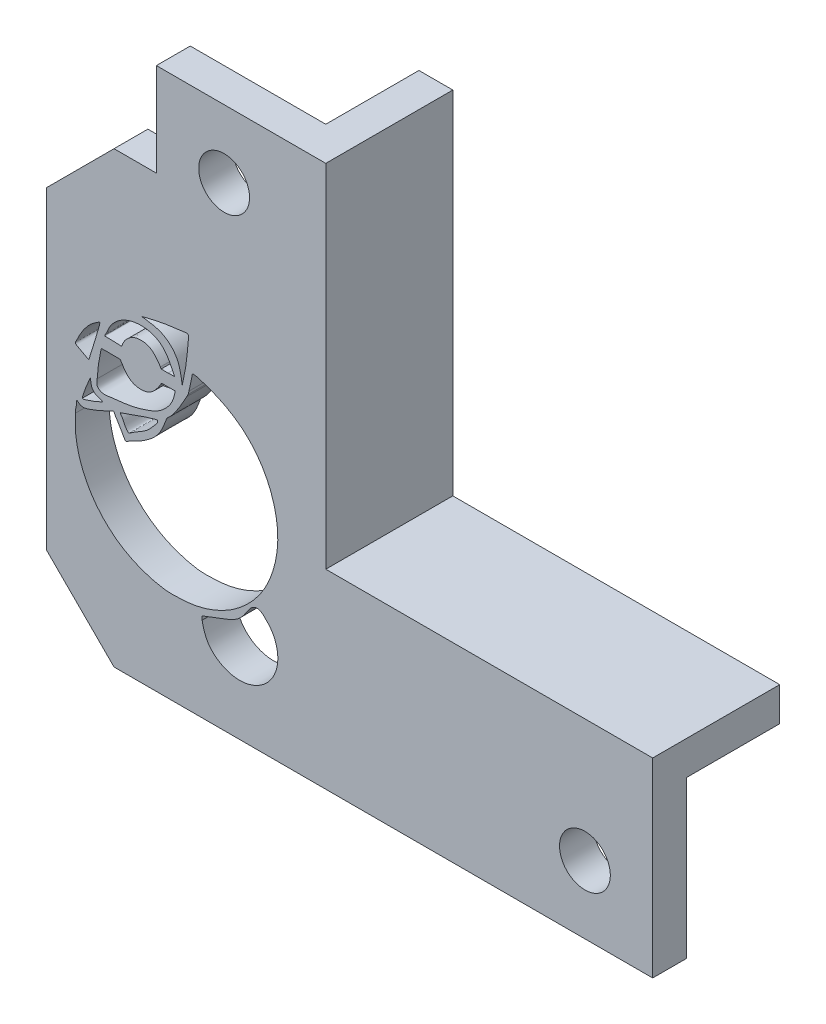
from build123d import *

# Parameters (mm, degrees)
CROQUIS1_R              = 1.5
SALIENTE_EXTRUIR1_DEPTH = 2
SALIENTE_EXTRUIR2_DEPTH = 7.5
CHAFL_N1_SIZE           = 4
CORTAR_EXTRUIR1_START   = -32
CROQUIS4_W              = 52.573461271
CROQUIS4_H              = 46.310311646
CORTAR_EXTRUIR1_DEPTH   = 32
CROQUIS5_W              = 10.5
CROQUIS5_H              = 26.5
SALIENTE_EXTRUIR3_DEPTH = 2
CHAFL_N2_SIZE           = 4
CORTAR_EXTRUIR2_REACH   = 63.708


with BuildPart() as part:
    # Croquis1 → Saliente-Extruir1 (new body)
    with BuildSketch(Plane.XY):
        Polygon((13.378145297, -2.248701868), (-7.921854703, -2.248701868), (-7.921854703, -24.998701868), (-15.921854703, -24.998701868), (-15.921854703, 7.001298132), (13.378145297, 7.001298132), align=None)
        with Locations((9.378145297, 3.001298132)):
            Circle(CROQUIS1_R, mode=Mode.SUBTRACT)
        with Locations((-11.921854703, -20.998701868)):
            Circle(CROQUIS1_R, mode=Mode.SUBTRACT)
    extrude(amount=-SALIENTE_EXTRUIR1_DEPTH)

    # Croquis3 → Saliente-Extruir2 (add)
    with BuildSketch(Plane.XY):
        Polygon((13.378145297, -2.248701868), (13.378145297, -4.248701868), (-5.921854703, -4.248701868), (-5.921854703, -24.998701868), (-7.921854703, -24.998701868), (-7.921854703, -2.248701868), align=None)
    extrude(amount=-SALIENTE_EXTRUIR2_DEPTH)

    # Chaflán1
    chafl_n1_edges = [part.edges().sort_by_distance(p)[0] for p in [
        (-15.921854703, 7.001298132, -1),
    ]]
    chamfer(chafl_n1_edges, length=CHAFL_N1_SIZE)

    # Simetría1: part across plane


with BuildPart() as part_1:
    add(part.part)
    add(part.part.mirror(Plane(origin=(0, -24.998701868, 0), x_dir=(0, 0, 1), z_dir=(0, -1, 0))))

    # Croquis4 → Cortar-Extruir1 (cut)
    with BuildSketch(Plane(origin=(0, 7.001298132, 0), x_dir=(1, 0, 0), z_dir=(0, 1, 0)).offset(CORTAR_EXTRUIR1_START)):
        with Locations((-0.931651779, 5.459653858)):
            Rectangle(CROQUIS4_W, CROQUIS4_H)
    extrude(amount=CORTAR_EXTRUIR1_DEPTH, mode=Mode.SUBTRACT)

    # Croquis5 → Saliente-Extruir3 (add)
    with BuildSketch(Plane.XY):
        with Locations((-17.171854703, -43.748701868)):
            Rectangle(CROQUIS5_W, CROQUIS5_H)
    extrude(amount=-SALIENTE_EXTRUIR3_DEPTH)

    # Chaflán2
    chafl_n2_edges = [part_1.edges().sort_by_distance(p)[0] for p in [
        (-22.421854703, -30.498701868, -1),
        (-22.421854703, -56.998701868, -1),
    ]]
    chamfer(chafl_n2_edges, length=CHAFL_N2_SIZE)

    # Croquis8 → Cortar-Extruir2 (cut, up to next)
    with BuildSketch(Plane.XY, mode=Mode.PRIVATE) as cortar_extruir2_sk1:
        with BuildLine():
            Line((-14.044729544, -40.872173253), (-14.129646544, -41.032729253))
            add(Edge.make_bspline(
                [(-20.705006544, -45.167052253), (-20.703037827, -45.133294056), (-20.699155691, -45.066725874), (-20.690742023, -44.969351431), (-20.677415733, -44.87833843), (-20.655365047, -44.79262746), (-20.636609746, -44.701448419), (-20.635500295, -44.615669691), (-20.639914268, -44.544339253), (-20.644246363, -44.494139489), (-20.6185225, -44.468164443), (-20.604262681, -44.468096191), (-20.600747971, -44.468337758), (-20.595851951, -44.46925171), (-20.589884195, -44.471844597), (-20.583430438, -44.476473908), (-20.576322835, -44.482648915), (-20.568128949, -44.489699828), (-20.558856877, -44.497542435), (-20.540821317, -44.512496469), (-20.513371946, -44.534018742), (-20.475141216, -44.560246941), (-20.434692418, -44.583122107), (-20.391966343, -44.601386897), (-20.347580458, -44.614988369), (-20.302026695, -44.623900063), (-20.255814326, -44.628063216), (-20.209445241, -44.628082217), (-20.135935247, -44.622553881), (-20.036199309, -44.602844305), (-19.913270508, -44.563311236), (-19.772080643, -44.509385453), (-19.61032218, -44.448814252), (-19.428985662, -44.379289174), (-19.245627792, -44.303936615), (-19.061640101, -44.219518609), (-18.875946522, -44.130882189), (-18.734104659, -44.064959045), (-18.635741238, -44.022095238), (-18.581881449, -43.996632733), (-18.539406349, -43.972737845), (-18.508269695, -43.952296584), (-18.486074791, -43.940684577), (-18.467229743, -43.937106582), (-18.454564891, -43.93839348), (-18.447726872, -43.939935972), (-18.433471082, -43.944924698), (-18.414792223, -43.962298457), (-18.401299755, -43.993678435), (-18.3856017, -44.04272852), (-18.357111095, -44.103454882), (-18.312778104, -44.170911649), (-18.260678998, -44.242945118), (-18.207767567, -44.327022469), (-18.153135778, -44.422896087), (-18.099697661, -44.520339315), (-18.045333167, -44.617118162), (-17.989943878, -44.712013455), (-17.938338551, -44.795842909), (-17.890274581, -44.86927064), (-17.848415814, -44.936648836), (-17.817766956, -44.99414292), (-17.797123087, -45.039650307), (-17.782382623, -45.067403116), (-17.756690298, -45.101624833), (-17.688741807, -45.104654868), (-17.61798697, -45.062240499), (-17.515561588, -44.995442849), (-17.388354369, -44.92223379), (-17.238412818, -44.854991018), (-17.096917049, -44.793305515), (-16.959949712, -44.720926595), (-16.823633083, -44.640548028), (-16.657502885, -44.535647549), (-16.464665793, -44.407961516), (-16.252183325, -44.249596382), (-16.064242859, -44.08305661), (-15.902717467, -43.907541978), (-15.765504043, -43.727724115), (-15.636220567, -43.520576014), (-15.522864406, -43.284281385), (-15.420327532, -43.023627653), (-15.354060554, -42.84434064), (-15.317235164, -42.749217882), (-15.312330024, -42.737840593), (-15.306465283, -42.726638347), (-15.299171159, -42.71595604), (-15.2907219, -42.705764696), (-15.280116284, -42.694585912), (-15.267386218, -42.68251691), (-15.252612806, -42.669562233), (-15.20242959, -42.626712199), (-15.120995523, -42.548812492), (-15.014801413, -42.430142918), (-14.902090336, -42.289341679), (-14.78271542, -42.127348778), (-14.65827842, -41.943582163), (-14.530197668, -41.740368587), (-14.398672187, -41.517616031), (-14.262880095, -41.275930433), (-14.174064465, -41.113808611), (-14.129646544, -41.032729253)],
                knots=[0, 0, 0, 0, 0.010102461, 0.019921161, 0.029199228, 0.037535452, 0.046355222, 0.056958127, 0.062929856, 0.067936689, 0.071475868, 0.071821303, 0.072174958, 0.07252821, 0.073304587, 0.074093107, 0.074893885, 0.076117244, 0.077322893, 0.078522026, 0.083117058, 0.087738974, 0.092361577, 0.096976683, 0.101592925, 0.106206404, 0.110819148, 0.115433642, 0.120044404, 0.132827452, 0.145679187, 0.158589989, 0.177979346, 0.197285621, 0.216611642, 0.237194022, 0.257754182, 0.27809032, 0.283918991, 0.289810489, 0.29588416, 0.298456043, 0.300940948, 0.303333987, 0.30403246, 0.30473431, 0.305424104, 0.308530173, 0.311930188, 0.315560225, 0.323929498, 0.331848343, 0.339651892, 0.350488604, 0.361503747, 0.372618426, 0.383691593, 0.394666847, 0.405444846, 0.413096848, 0.420887988, 0.429132565, 0.432553991, 0.435785551, 0.438589189, 0.444871479, 0.453410879, 0.463206766, 0.481416821, 0.497174303, 0.512277313, 0.527523731, 0.543418375, 0.559550164, 0.58622093, 0.612500223, 0.638664539, 0.661116856, 0.683659116, 0.706150103, 0.733948749, 0.76181638, 0.789817342, 0.791056612, 0.792290263, 0.793517394, 0.794828072, 0.796146494, 0.797468753, 0.799429686, 0.80138505, 0.803338704, 0.819145188, 0.835000317, 0.850886116, 0.873014149, 0.895102365, 0.917178253, 0.944771031, 0.972379231, 1, 1, 1, 1], degree=3))
            add(Edge.make_bspline(
                [(-13.998423544, -40.681013253), (-13.990343732, -40.64680302), (-13.974158665, -40.578274824), (-13.950338218, -40.475087032), (-13.927191014, -40.370023541), (-13.905348443, -40.263317985), (-13.88382684, -40.156269636), (-13.863296522, -40.058123119), (-13.842694337, -39.968229842), (-13.82541877, -39.882576034), (-13.815930974, -39.811848315), (-13.811462831, -39.758228536), (-13.805947222, -39.726469143), (-13.791130933, -39.698670483), (-13.761788679, -39.68670709), (-13.729156011, -39.685116117), (-13.675047312, -39.689085845), (-13.604052708, -39.698873294), (-13.519005633, -39.717716538), (-13.171829075, -39.813721641), (-12.556867704, -40.022005641), (-11.705924127, -40.422265383), (-10.914526634, -40.939788031), (-10.235199352, -41.583674084), (-9.680432935, -42.322325548), (-9.244961462, -43.144366644), (-8.935442852, -44.02981885), (-8.762202688, -44.957606633), (-8.740525264, -45.735844745), (-8.798629224, -46.343271618), (-8.874497345, -46.783228888), (-8.981354092, -47.216026256), (-9.116888842, -47.640134894), (-9.282005521, -48.052962849), (-9.474757271, -48.445797105), (-9.694146132, -48.816219131), (-9.93646291, -49.16345967), (-10.172944251, -49.454488516), (-10.39349035, -49.694947958), (-10.590321893, -49.891132291), (-10.788518281, -50.072710327), (-10.986432676, -50.240844569), (-11.183730481, -50.395276561), (-11.388469443, -50.541228168), (-11.601015565, -50.677292459), (-11.820356067, -50.8040683), (-12.039042561, -50.91887496), (-12.255794758, -51.023243695), (-12.47027691, -51.117114572), (-12.686608407, -51.201870481), (-12.904631429, -51.276988925), (-13.123863613, -51.342779816), (-13.346742537, -51.400190518), (-13.572899582, -51.449124285), (-13.802032605, -51.489073805), (-14.011460861, -51.516647132), (-14.200476676, -51.534431863), (-14.368601106, -51.545853737), (-14.541047747, -51.55397222), (-14.717740074, -51.5594178), (-14.898708503, -51.561923864), (-15.062850816, -51.561393287), (-15.210081302, -51.558746919), (-15.340175614, -51.552274411), (-15.450528857, -51.541062404), (-15.540943171, -51.526771753), (-15.612017775, -51.513638047), (-15.684661798, -51.499270787), (-15.759036911, -51.484643451), (-15.83509315, -51.469512276), (-15.901703025, -51.455888293), (-15.958869273, -51.443776489), (-16.006508696, -51.432870592), (-16.043336034, -51.423377248), (-16.069476586, -51.415925624), (-16.08516969, -51.41135129), (-16.103608463, -51.405999268), (-16.12484761, -51.400063603), (-16.148892837, -51.393574282), (-16.173994231, -51.386946978), (-16.200134403, -51.380116861), (-16.227298464, -51.373021788), (-16.462369441, -51.311074195), (-16.899571244, -51.168521868), (-17.515319676, -50.889972439), (-18.095626628, -50.545172213), (-18.631232393, -50.137206166), (-19.116081976, -49.672655866), (-19.546971992, -49.154678963), (-19.917136488, -48.588939643), (-20.223143238, -47.984323086), (-20.397720279, -47.520194788), (-20.488678573, -47.220495139), (-20.524261812, -47.093223743), (-20.557108378, -46.964575459), (-20.58707047, -46.83455569), (-20.613916706, -46.703196544), (-20.63866422, -46.562627424), (-20.660758776, -46.412806025), (-20.678755476, -46.253778779), (-20.698108712, -46.119705712), (-20.700704215, -46.009293858), (-20.704366052, -45.923920583), (-20.707495792, -45.823055472), (-20.709949204, -45.706727856), (-20.710954488, -45.574930992), (-20.710396489, -45.45638274), (-20.708880896, -45.351098049), (-20.707061958, -45.259072406), (-20.705691682, -45.197725632), (-20.705006544, -45.167052253)],
                knots=[0, 0, 0, 0, 0.00368188, 0.007375354, 0.011092413, 0.01495015, 0.018783555, 0.022529584, 0.025452112, 0.028443752, 0.031677896, 0.032922261, 0.034073702, 0.035058537, 0.036051599, 0.037215263, 0.038477489, 0.041725717, 0.044714912, 0.04759364, 0.079453226, 0.112577013, 0.145859162, 0.178044726, 0.210101335, 0.242201911, 0.275109078, 0.3079723, 0.340687584, 0.35626413, 0.371832425, 0.387406458, 0.402922079, 0.418431886, 0.433936338, 0.448707516, 0.463482076, 0.478248592, 0.487948973, 0.497647174, 0.507347835, 0.516096246, 0.524841935, 0.533583544, 0.542422328, 0.55126529, 0.560111433, 0.568286779, 0.576458743, 0.584628627, 0.592616271, 0.600605919, 0.608597149, 0.616717379, 0.624836127, 0.632952678, 0.638835793, 0.644719109, 0.650601579, 0.65691753, 0.663234443, 0.669557664, 0.674109826, 0.678657299, 0.683197693, 0.685719429, 0.688243298, 0.690767947, 0.693475774, 0.696182845, 0.698890441, 0.700597127, 0.702303447, 0.70400911, 0.704579791, 0.705150529, 0.705721269, 0.706590835, 0.70746038, 0.708329939, 0.709310128, 0.710290316, 0.711270639, 0.734773189, 0.758343453, 0.781923014, 0.805322397, 0.828712755, 0.852107884, 0.875743558, 0.899374379, 0.922951063, 0.927566333, 0.932179158, 0.93679177, 0.941472499, 0.946153493, 0.950833384, 0.956421494, 0.962011022, 0.967602283, 0.970586337, 0.973570289, 0.976554253, 0.981155725, 0.98575742, 0.990359057, 0.993572725, 0.996786363, 1, 1, 1, 1], degree=3))
            Line((-13.998423544, -40.681013253), (-14.044729544, -40.872173253))
        make_face()
    cortar_extruir2_tool1 = extrude(cortar_extruir2_sk1.sketch, amount=-CORTAR_EXTRUIR2_REACH, mode=Mode.PRIVATE) & part_1.part
    # Croquis8 → Cortar-Extruir2 (cut, up to next)
    with BuildSketch(Plane.XY, mode=Mode.PRIVATE) as cortar_extruir2_sk2:
        with BuildLine():
            add(Edge.make_bspline(
                [(-19.095541544, -43.788163253), (-19.135068505, -43.750795853), (-19.207399393, -43.682416774), (-19.352125395, -43.676033352), (-19.467373526, -43.627853466), (-19.567540577, -43.564165879), (-19.648894301, -43.48587507), (-19.716317063, -43.390145255), (-19.76077667, -43.276977914), (-19.786366686, -43.153258263), (-19.796913952, -43.069233697), (-19.802232544, -43.026863253)],
                knots=[0, 0, 0, 0, 0.138926967, 0.254224219, 0.368506321, 0.467541319, 0.567311693, 0.665828651, 0.775567539, 0.886827109, 1, 1, 1, 1], degree=3))
            Line((-19.802232544, -43.026863253), (-19.807092544, -42.898086253))
            Line((-19.807092544, -42.898086253), (-19.841481544, -42.966429253))
            add(Edge.make_bspline(
                [(-19.841481544, -42.966429253), (-19.857436606, -43.000330852), (-19.889337505, -43.06811445), (-19.936424127, -43.170095455), (-19.984272005, -43.277852931), (-20.031717407, -43.391923496), (-20.079054609, -43.512291781), (-20.12465438, -43.632950573), (-20.169197214, -43.753446422), (-20.211375676, -43.873640162), (-20.241221826, -43.966503564), (-20.260415019, -44.031666109), (-20.271639076, -44.069129287), (-20.281426971, -44.099501289), (-20.289454447, -44.122577549), (-20.293503791, -44.138523316), (-20.293980828, -44.152381819), (-20.291417957, -44.163245287), (-20.28838685, -44.171546133), (-20.286039347, -44.177015269), (-20.284855544, -44.179773253)],
                knots=[0, 0, 0, 0, 0.086455838, 0.172861691, 0.259182216, 0.3584918, 0.457904427, 0.557617865, 0.656119282, 0.754323547, 0.851519656, 0.881142959, 0.911068233, 0.941757667, 0.954765921, 0.967437939, 0.979627493, 0.986267999, 0.993075204, 1, 1, 1, 1], degree=3))
            add(Edge.make_bspline(
                [(-20.284855544, -44.179773253), (-20.281314613, -44.183780698), (-20.274376679, -44.191632698), (-20.263334419, -44.202251939), (-20.24826764, -44.212127668), (-20.226569201, -44.215333447), (-20.2014511, -44.211232304), (-20.167596079, -44.201613991), (-20.125927041, -44.189524348), (-20.077222894, -44.174958263), (-20.010817899, -44.154253192), (-19.925571971, -44.125736107), (-19.821302589, -44.088492775), (-19.716515306, -44.049380465), (-19.611858293, -44.009275655), (-19.507695426, -43.967969938), (-19.404136479, -43.92518844), (-19.301083512, -43.880573251), (-19.198225314, -43.834673695), (-19.129779156, -43.803671123), (-19.095541544, -43.788163253)],
                knots=[0, 0, 0, 0, 0.012523857, 0.02453866, 0.035838432, 0.054146444, 0.074152983, 0.095219874, 0.136560316, 0.175805679, 0.214299387, 0.29950237, 0.386353151, 0.473660751, 0.56151079, 0.648900137, 0.736147685, 0.823979093, 0.911952172, 1, 1, 1, 1], degree=3))
        make_face()
    cortar_extruir2_tool2 = extrude(cortar_extruir2_sk2.sketch, amount=-CORTAR_EXTRUIR2_REACH, mode=Mode.PRIVATE) & part_1.part
    # Croquis8 → Cortar-Extruir2 (cut, up to next)
    with BuildSketch(Plane.XY, mode=Mode.PRIVATE) as cortar_extruir2_sk3:
        with BuildLine():
            Line((-18.052859544, -41.086239253), (-18.612036544, -41.083947253))
            add(Edge.make_bspline(
                [(-19.415228544, -42.758708253), (-19.411351648, -42.70313171), (-19.4035973, -42.591970626), (-19.390731499, -42.425288059), (-19.375342945, -42.258124421), (-19.356159583, -42.09069107), (-19.333210477, -41.923207488), (-19.306754782, -41.757399259), (-19.276853706, -41.593217078), (-19.244585822, -41.430036052), (-19.220082029, -41.311169163), (-19.204627591, -41.236528985), (-19.198125794, -41.206680575), (-19.191720644, -41.179972995), (-19.18531796, -41.156271739), (-19.180075556, -41.134720359), (-19.177008632, -41.116755026), (-19.17565557, -41.102812003), (-19.174269259, -41.093968044), (-19.170625583, -41.081549407), (-19.150869421, -41.072679204), (-19.124541883, -41.077778931), (-19.080665073, -41.087514317), (-19.023363146, -41.094648285), (-18.956049043, -41.090555811), (-18.884380457, -41.081479313), (-18.802115945, -41.078199226), (-18.708174086, -41.079770676), (-18.644343626, -41.082543712), (-18.612036544, -41.083947253)],
                knots=[0, 0, 0, 0, 0.074066517, 0.148143691, 0.222253857, 0.297230641, 0.372176775, 0.446980379, 0.520435723, 0.594028149, 0.668120053, 0.681787891, 0.695363799, 0.708732214, 0.718294905, 0.728004309, 0.738206528, 0.742505042, 0.746591986, 0.750184642, 0.759180954, 0.771452827, 0.785687924, 0.819014869, 0.847720156, 0.875100318, 0.915063328, 0.957010241, 1, 1, 1, 1], degree=3))
            add(Edge.make_bspline(
                [(-14.813138544, -41.134850253), (-14.82684677, -41.194122264), (-14.854194373, -41.312368596), (-14.902035057, -41.487612058), (-14.965088146, -41.66226432), (-15.051534527, -41.831832805), (-15.158777295, -41.994955339), (-15.281112362, -42.148005305), (-15.415094513, -42.291110599), (-15.560335747, -42.422242216), (-15.739795952, -42.557027682), (-15.95990646, -42.684427825), (-16.219416959, -42.800211424), (-16.509501023, -42.906521068), (-16.826152673, -43.008851148), (-17.169529556, -43.100923852), (-17.524876568, -43.17427563), (-17.892818119, -43.223941473), (-18.27262196, -43.263738281), (-18.58582331, -43.300732775), (-18.829892429, -43.339074847), (-19.00738037, -43.349891191), (-19.155206567, -43.323618847), (-19.263945244, -43.274100979), (-19.337163065, -43.223511437), (-19.405209807, -43.148250463), (-19.44036975, -43.034483024), (-19.436276754, -42.898792844), (-19.422405784, -42.806475772), (-19.415228544, -42.758708253)],
                knots=[0, 0, 0, 0, 0.030514359, 0.060875462, 0.091074006, 0.123479492, 0.15609226, 0.188834739, 0.22164437, 0.254321208, 0.28686301, 0.334052987, 0.381523556, 0.429239389, 0.488964635, 0.548389694, 0.607474455, 0.670826696, 0.734521295, 0.799047955, 0.828969223, 0.85845257, 0.887902853, 0.903100192, 0.918088884, 0.932304376, 0.953174594, 0.975771183, 1, 1, 1, 1], degree=3))
            Line((-14.813138544, -41.134850253), (-14.807113544, -41.081600253))
            Line((-14.807113544, -41.081600253), (-15.215977544, -41.083917253))
            Line((-15.215977544, -41.083917253), (-15.624842544, -41.086234253))
            Line((-15.624842544, -41.086234253), (-15.649963544, -41.157592253))
            add(Edge.make_bspline(
                [(-18.052859544, -41.086239253), (-17.981303268, -41.211357194), (-17.852291083, -41.436938231), (-17.612213432, -41.723511986), (-17.335310984, -41.926464208), (-17.006974157, -42.016586433), (-16.672217847, -42.016743721), (-16.343972145, -41.926722256), (-16.065972956, -41.724552818), (-15.844420637, -41.45470142), (-15.715543485, -41.25779123), (-15.649963544, -41.157592253)],
                knots=[0, 0, 0, 0, 0.136926273, 0.246870838, 0.353654368, 0.457939088, 0.564976413, 0.669270279, 0.776089701, 0.88606185, 1, 1, 1, 1], degree=3))
        make_face()
    cortar_extruir2_tool3 = extrude(cortar_extruir2_sk3.sketch, amount=-CORTAR_EXTRUIR2_REACH, mode=Mode.PRIVATE) & part_1.part
    # Croquis8 → Cortar-Extruir2 (cut, up to next)
    with BuildSketch(Plane.XY, mode=Mode.PRIVATE) as cortar_extruir2_sk4:
        with BuildLine():
            Line((-15.640831544, -40.372668253), (-15.234055544, -40.374984253))
            Line((-15.234055544, -40.374984253), (-14.852051544, -40.359285253))
            Line((-14.852051544, -40.359285253), (-14.858065544, -40.325838253))
            add(Edge.make_bspline(
                [(-14.858065544, -40.325838253), (-14.935055113, -40.162676721), (-15.086095764, -39.842581102), (-15.354230735, -39.394901381), (-15.713998272, -39.025964531), (-16.182560738, -38.807594966), (-16.698370232, -38.720474616), (-17.237400744, -38.751143591), (-17.76268671, -38.906766506), (-18.237220577, -39.192041369), (-18.513947365, -39.485842975), (-18.652263076, -39.693319946), (-18.701952633, -39.777693911), (-18.745268254, -39.863647991), (-18.780443567, -39.954457922), (-18.820415326, -40.055389181), (-18.8724863, -40.149056585), (-18.921507284, -40.23313973), (-18.964442797, -40.291247501), (-18.950880495, -40.346285628), (-18.927558666, -40.351680832), (-18.915279735, -40.353726984), (-18.890967649, -40.355991253), (-18.856154848, -40.358070974), (-18.811161957, -40.358662649), (-18.752450662, -40.358187972), (-18.678698538, -40.35815513), (-18.41466452, -40.358998394), (-18.180174968, -40.370356697), (-17.975518544, -40.38026993)],
                knots=[0, 0, 0, 0, 0.082563122, 0.161975028, 0.238036957, 0.314442053, 0.394253297, 0.475384485, 0.559531577, 0.642495059, 0.726015114, 0.7415088, 0.756605483, 0.770808044, 0.785500876, 0.80115829, 0.820458747, 0.834373164, 0.845936228, 0.852822997, 0.854559115, 0.856516631, 0.85857212, 0.865704858, 0.872491495, 0.879156199, 0.892579815, 0.906246437, 1, 1, 1, 1], degree=3))
            add(Edge.make_bspline(
                [(-15.682948544, -40.282112189), (-15.742298486, -40.194826918), (-15.864339862, -40.015342082), (-16.07648814, -39.766809522), (-16.34762618, -39.573640509), (-16.668206597, -39.487547813), (-16.996526451, -39.489276921), (-17.319728614, -39.576788454), (-17.590853724, -39.772885015), (-17.840522786, -40.029802623), (-17.928546863, -40.258325073), (-17.975518544, -40.38026993)],
                knots=[0, 0, 0, 0, 0.105184105, 0.216290235, 0.32422891, 0.431263952, 0.541221153, 0.648749654, 0.758594965, 0.871180699, 1, 1, 1, 1], degree=3))
            Line((-15.682948544, -40.282112189), (-15.640831544, -40.372668253))
        make_face()
    cortar_extruir2_tool4 = extrude(cortar_extruir2_sk4.sketch, amount=-CORTAR_EXTRUIR2_REACH, mode=Mode.PRIVATE) & part_1.part
    # Croquis8 → Cortar-Extruir2 (cut, up to next)
    with BuildSketch(Plane.XY, mode=Mode.PRIVATE) as cortar_extruir2_sk5:
        with BuildLine():
            add(Edge.make_bspline(
                [(-16.677032544, -38.273380253), (-16.545214413, -38.290985612), (-16.283248779, -38.325973204), (-15.896420979, -38.40633855), (-15.52980876, -38.54332999), (-15.204172818, -38.756289294), (-14.928243235, -39.025590522), (-14.707154402, -39.346112245), (-14.560655864, -39.709614446), (-14.470148336, -40.094962751), (-14.428297056, -40.356399232), (-14.407239544, -40.487941253)],
                knots=[0, 0, 0, 0, 0.113371723, 0.225306604, 0.336246298, 0.444835381, 0.554498608, 0.663116485, 0.774289776, 0.88643368, 1, 1, 1, 1], degree=3))
            Line((-14.407239544, -40.487941253), (-14.406432544, -40.604581253))
            Line((-14.406432544, -40.604581253), (-14.385166544, -40.524301253))
            add(Edge.make_bspline(
                [(-14.385166544, -40.524301253), (-14.36825796, -40.447173709), (-14.334427878, -40.292859708), (-14.285172991, -40.060898828), (-14.235055037, -39.808585377), (-14.187060571, -39.535616768), (-14.14412824, -39.242438083), (-14.110571698, -38.944537114), (-14.088572802, -38.641393162), (-14.065500593, -38.331121913), (-14.038579614, -38.105333538), (-14.015224935, -37.965096001), (-14.012020204, -37.910429361), (-14.021384098, -37.864745602), (-14.038961739, -37.831443873), (-14.057145646, -37.808744227), (-14.083718235, -37.787847415), (-14.122542602, -37.777987761), (-14.16817434, -37.781270485), (-14.296656465, -37.805437582), (-14.504097781, -37.836391432), (-14.788578451, -37.86697758), (-15.067700463, -37.897443204), (-15.346719093, -37.940251361), (-15.627468767, -37.991997815), (-15.899156122, -38.047514707), (-16.160614678, -38.103297698), (-16.411085255, -38.161225929), (-16.586172119, -38.206519419), (-16.687199221, -38.23471285), (-16.715058864, -38.242387198), (-16.740434684, -38.249085282), (-16.763354248, -38.254756695), (-16.783744081, -38.259953909), (-16.800061877, -38.264587196), (-16.81229473, -38.268492859), (-16.820626077, -38.270808873), (-16.826579765, -38.271836912), (-16.829988517, -38.27212831), (-16.830847003, -38.272214546), (-16.831644906, -38.272342279), (-16.832372854, -38.27251102), (-16.833008058, -38.272753537), (-16.83350037, -38.273103501), (-16.833842466, -38.273501327), (-16.83405557, -38.273890614), (-16.834788374, -38.275372639), (-16.830984005, -38.280072762), (-16.822665927, -38.276300581), (-16.808647367, -38.274552851), (-16.791049288, -38.271327542), (-16.772100166, -38.272454846), (-16.753415499, -38.275351989), (-16.731298863, -38.275999604), (-16.704894747, -38.275119951), (-16.686488634, -38.273970686), (-16.677032544, -38.273380253)],
                knots=[0, 0, 0, 0, 0.041211644, 0.082454766, 0.12376615, 0.175470379, 0.22709411, 0.278396704, 0.331897104, 0.385715422, 0.440790454, 0.450477377, 0.459920889, 0.469238896, 0.474355874, 0.479450405, 0.484330803, 0.491741293, 0.49967899, 0.508079233, 0.559980541, 0.609075671, 0.657419675, 0.706510199, 0.756366252, 0.806409976, 0.851239438, 0.895899563, 0.940581286, 0.945614564, 0.950644052, 0.955663793, 0.959312106, 0.962967283, 0.966646092, 0.968163061, 0.969669433, 0.971157199, 0.971305687, 0.971455124, 0.97160743, 0.971727099, 0.971844795, 0.971959955, 0.972038306, 0.972116276, 0.972191883, 0.972887107, 0.974375631, 0.976329758, 0.98051289, 0.983536713, 0.986209497, 0.990375403, 0.99505539, 1, 1, 1, 1], degree=3))
        make_face()
    cortar_extruir2_tool5 = extrude(cortar_extruir2_sk5.sketch, amount=-CORTAR_EXTRUIR2_REACH, mode=Mode.PRIVATE) & part_1.part
    # Croquis8 → Cortar-Extruir2 (cut, up to next)
    with BuildSketch(Plane.XY, mode=Mode.PRIVATE) as cortar_extruir2_sk6:
        with BuildLine():
            add(Edge.make_bspline(
                [(-13.113712544, -51.741711253), (-12.98073058, -51.691887132), (-12.715051085, -51.592345458), (-12.317679763, -51.442104435), (-11.922231103, -51.289904313), (-11.528413185, -51.134075224), (-11.147457397, -50.926630108), (-10.814977274, -50.619939076), (-10.567681422, -50.242273892), (-10.335447878, -49.889722526), (-10.045841347, -49.75490885), (-9.889236729, -49.783790963), (-9.833211071, -49.800131999), (-9.758690762, -49.83068722), (-9.671419235, -49.884304337), (-9.577531731, -49.964362889), (-9.486581449, -50.054857655), (-9.39263766, -50.149337437), (-9.29813997, -50.249857518), (-9.123470997, -50.455652057), (-8.917037413, -50.810306755), (-8.764363854, -51.333926592), (-8.736061685, -51.872802226), (-8.835182692, -52.392248363), (-9.044201042, -52.865706049), (-9.360412773, -53.287495976), (-9.777177851, -53.627395068), (-10.267952769, -53.866420881), (-10.754995126, -53.975729561), (-11.20404931, -53.97503244), (-11.600907707, -53.901693967), (-11.978441408, -53.761325648), (-12.326009768, -53.561478829), (-12.630398517, -53.30840351), (-12.879018326, -53.003177942), (-13.04905365, -52.649443147), (-13.155782123, -52.31261595), (-13.201727008, -52.094021245), (-13.220632544, -52.004073253)],
                knots=[0, 0, 0, 0, 0.03272217, 0.06537435, 0.09788773, 0.13036155, 0.162946785, 0.197267555, 0.2332432, 0.266704899, 0.29431021, 0.298678175, 0.303194604, 0.307747407, 0.317198537, 0.326637183, 0.336124691, 0.346757121, 0.357338657, 0.367904915, 0.408927206, 0.450665574, 0.4925268, 0.532054346, 0.571428795, 0.61078233, 0.652423882, 0.694129273, 0.735517518, 0.76624478, 0.797020657, 0.828024163, 0.858615484, 0.888973342, 0.918776185, 0.948546188, 0.978827634, 1, 1, 1, 1], degree=3))
            Line((-13.113712544, -51.741711253), (-13.220632544, -51.781770784))
            Line((-13.220632544, -51.781770784), (-13.220632544, -52.004073253))
        make_face()
    cortar_extruir2_tool6 = extrude(cortar_extruir2_sk6.sketch, amount=-CORTAR_EXTRUIR2_REACH, mode=Mode.PRIVATE) & part_1.part
    # Croquis8 → Cortar-Extruir2 (cut, up to next)
    with BuildSketch(Plane.XY, mode=Mode.PRIVATE) as cortar_extruir2_sk7:
        with BuildLine():
            add(Edge.make_bspline(
                [(-20.677944544, -41.492100253), (-20.634918331, -41.411627885), (-20.56121958, -41.243779578), (-20.432415875, -40.99843204), (-20.296369004, -40.76509764), (-20.14839124, -40.550398381), (-19.996621624, -40.35943043), (-19.847100265, -40.199288643), (-19.695721425, -40.068516938), (-19.530825566, -39.951967238), (-19.402509809, -39.867279045), (-19.315585795, -39.812813885), (-19.291869368, -39.798515351), (-19.264279242, -39.795164118), (-19.258568006, -39.821071111), (-19.261399217, -39.846289237), (-19.270730872, -39.903971479), (-19.288088967, -39.980900423), (-19.315929264, -40.074316525), (-19.352931063, -40.183486252), (-19.393688027, -40.320405561), (-19.439955689, -40.487251122), (-19.485533915, -40.653030295), (-19.531985281, -40.812767905), (-19.578229028, -40.965618116), (-19.626432294, -41.121247165), (-19.676261991, -41.280827847), (-19.727666515, -41.44444098), (-19.767779249, -41.571576326), (-19.796399566, -41.662131991), (-19.81343543, -41.716403361), (-19.829216975, -41.767406935), (-19.843659462, -41.815014081), (-19.856701124, -41.858736583), (-19.867414042, -41.895288875), (-19.875967487, -41.924922036), (-19.88238292, -41.94859073), (-19.887804786, -41.9709504), (-19.892227324, -41.991549478), (-19.897051921, -42.007899824), (-19.906386021, -42.02694525), (-19.938371408, -42.029219451), (-19.97051938, -42.009358493), (-20.032281332, -41.969854546), (-20.114989588, -41.919184215), (-20.218241592, -41.867959759), (-20.314604254, -41.823347007), (-20.410408784, -41.773925826), (-20.512257567, -41.717719539), (-20.59564779, -41.670419734), (-20.65740914, -41.634901468), (-20.68990503, -41.611374113), (-20.709471923, -41.580880714), (-20.705627087, -41.549157047), (-20.693677219, -41.521085581), (-20.683280731, -41.502080579), (-20.677944544, -41.492100253)],
                knots=[0, 0, 0, 0, 0.048923359, 0.098274455, 0.148594251, 0.193744338, 0.238041438, 0.279375751, 0.311073579, 0.345219117, 0.387457927, 0.394117996, 0.399629093, 0.403042842, 0.406340556, 0.41143029, 0.417393229, 0.43727564, 0.453958491, 0.469590657, 0.499137083, 0.53057206, 0.56248912, 0.591376087, 0.61981994, 0.648164323, 0.678785367, 0.709512998, 0.740174444, 0.75030894, 0.760465546, 0.770692216, 0.778952604, 0.787156434, 0.795171091, 0.799387378, 0.803705197, 0.808321891, 0.811746897, 0.814957846, 0.817603736, 0.822431029, 0.829505271, 0.837911934, 0.861751001, 0.881500403, 0.899703853, 0.918724139, 0.939319162, 0.962106215, 0.970182512, 0.977504444, 0.983619004, 0.988390642, 0.993932438, 1, 1, 1, 1], degree=3))
        make_face()
    cortar_extruir2_tool7 = extrude(cortar_extruir2_sk7.sketch, amount=-CORTAR_EXTRUIR2_REACH, mode=Mode.PRIVATE) & part_1.part
    # Croquis8 → Cortar-Extruir2 (cut, up to next)
    with BuildSketch(Plane.XY, mode=Mode.PRIVATE) as cortar_extruir2_sk8:
        with BuildLine():
            add(Edge.make_bspline(
                [(-18.040631544, -43.799245253), (-18.039514124, -43.798593081), (-18.036356889, -43.798394578), (-18.032358201, -43.797225097), (-18.027585658, -43.796190607), (-18.022293283, -43.795019394), (-18.016393878, -43.793829953), (-18.010336777, -43.792692174), (-18.004115217, -43.79162195), (-17.99775026, -43.790523576), (-17.988158508, -43.78870938), (-17.975465545, -43.785522364), (-17.959800261, -43.780665874), (-17.939278209, -43.773698107), (-17.913765345, -43.765111953), (-17.883303073, -43.754843841), (-17.850136553, -43.743511183), (-17.814306683, -43.730903612), (-17.775755798, -43.7170529), (-17.638742899, -43.667349745), (-17.403347671, -43.582508077), (-17.073706468, -43.465445717), (-16.787856832, -43.365885623), (-16.542826842, -43.282628973), (-16.323126066, -43.211503805), (-16.141875866, -43.156833434), (-16.000439892, -43.114961572), (-15.928213279, -43.099794848), (-15.832579152, -43.085954803), (-15.847443553, -43.252325385), (-15.972164478, -43.369294229), (-16.127543973, -43.575318333), (-16.30676564, -43.766226661), (-16.491537994, -43.938941433), (-16.686730989, -44.078499582), (-16.908552165, -44.205671463), (-17.159350523, -44.347911332), (-17.343805563, -44.469976673), (-17.457861285, -44.556558299), (-17.503804655, -44.584746469), (-17.551562968, -44.593776773), (-17.590761873, -44.575996637), (-17.621919773, -44.549980097), (-17.669279668, -44.498727764), (-17.72591258, -44.421984028), (-17.783022516, -44.318069456), (-17.829544316, -44.216845043), (-17.874458139, -44.118900458), (-17.926009536, -44.023784349), (-17.978196899, -43.950908732), (-18.022658793, -43.899378318), (-18.0473584, -43.864027454), (-18.052322826, -43.83286186), (-18.047343577, -43.814915474), (-18.04362444, -43.807755489), (-18.042908889, -43.800574408), (-18.040631544, -43.799245253)],
                knots=[0, 0, 0, 0, 0.000764613, 0.001529126, 0.002293631, 0.003370575, 0.004447482, 0.005524639, 0.006681922, 0.007838738, 0.008994659, 0.011925565, 0.01486239, 0.017803901, 0.023568377, 0.029324029, 0.035073653, 0.042397558, 0.049729306, 0.057080234, 0.120697912, 0.184150021, 0.245015537, 0.283280341, 0.323248532, 0.36880434, 0.385867264, 0.401005847, 0.411539516, 0.428157151, 0.465111398, 0.50987545, 0.563703184, 0.606516744, 0.645332561, 0.692327529, 0.743801388, 0.800242226, 0.810954861, 0.820709132, 0.82912403, 0.835681273, 0.843057666, 0.850892012, 0.873108543, 0.894095499, 0.914480774, 0.932952958, 0.951975672, 0.97252579, 0.980900692, 0.988609423, 0.995438506, 0.99691364, 0.998441688, 1, 1, 1, 1], degree=3))
        make_face()
    cortar_extruir2_tool8 = extrude(cortar_extruir2_sk8.sketch, amount=-CORTAR_EXTRUIR2_REACH, mode=Mode.PRIVATE) & part_1.part
    add(cortar_extruir2_tool1.solids().sort_by_distance((-14.178863, -46.355991, 0))[0], mode=Mode.SUBTRACT)
    add(cortar_extruir2_tool2.solids().sort_by_distance((-19.809913, -43.726529, 0))[0], mode=Mode.SUBTRACT)
    add(cortar_extruir2_tool3.solids().sort_by_distance((-17.52978, -42.208121, 0))[0], mode=Mode.SUBTRACT)
    add(cortar_extruir2_tool4.solids().sort_by_distance((-15.437192, -40.329617, 0))[0], mode=Mode.SUBTRACT)
    add(cortar_extruir2_tool5.solids().sort_by_distance((-14.826881, -38.621159, 0))[0], mode=Mode.SUBTRACT)
    add(cortar_extruir2_tool6.solids().sort_by_distance((-10.748579, -52.11008, 0))[0], mode=Mode.SUBTRACT)
    add(cortar_extruir2_tool7.solids().sort_by_distance((-19.962971, -41.01199, 0))[0], mode=Mode.SUBTRACT)
    add(cortar_extruir2_tool8.solids().sort_by_distance((-17.016913, -43.817608, 0))[0], mode=Mode.SUBTRACT)


solid = part_1.part
